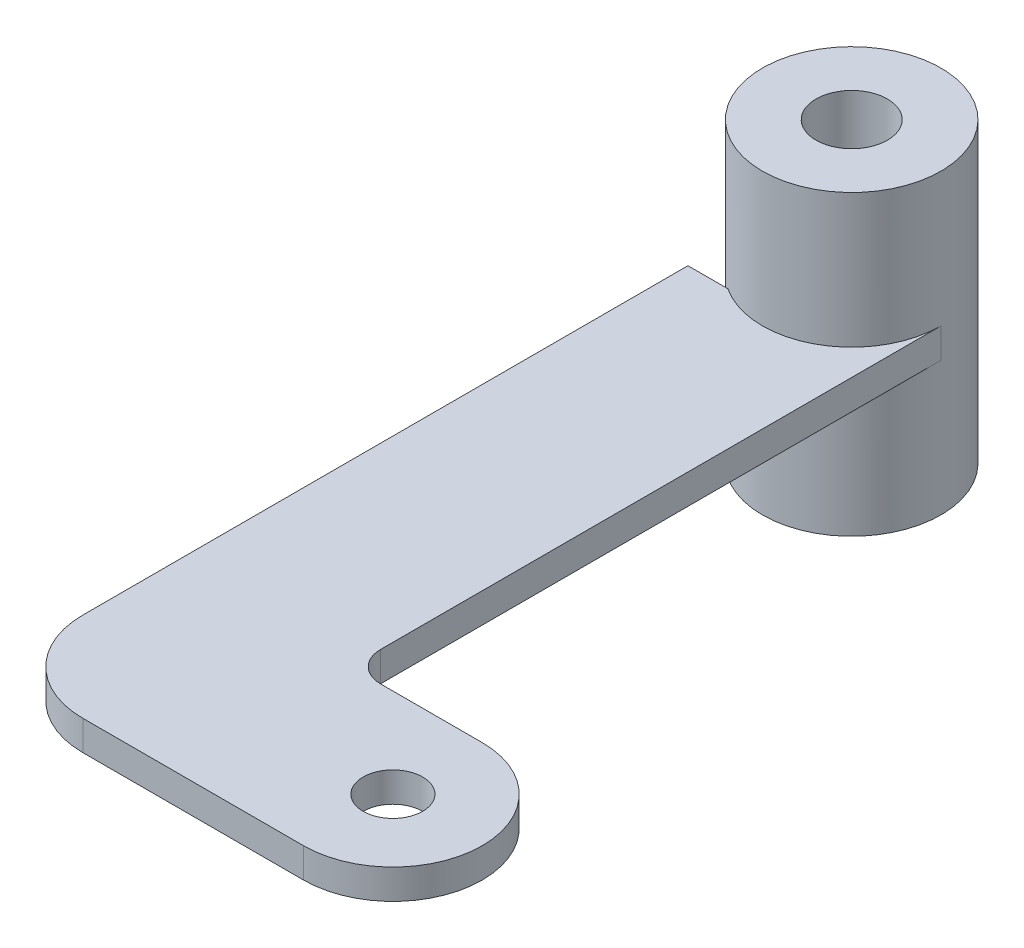
from build123d import *
from OCP.BRepFilletAPI import BRepFilletAPI_MakeFillet

# Parameters (mm, degrees)
SKETCH7_R           = 5
BOSS_EXTRUDE2_DEPTH = 2.5
FILLET2_R1          = 5
FILLET2_R2          = 15


with BuildPart() as part:
    # Sketch4 → Revolve1 (revolve)
    with BuildSketch(Plane.XY):
        Polygon((5, 5), (5, -5), (6, -5), (6, -25), (15, -25), (15, 25), (6, 25), (6, 5), align=None)
    revolve(axis=Axis((0, 25, 0), (0, -1, 0)))

    # Sketch7 → Boss-Extrude2 (add, symmetric)
    with BuildSketch(Plane(origin=(0, 0, 0), x_dir=(1, 0, 0), z_dir=(0, 1, 0))):
        with BuildLine():
            Line((-15, -12.5), (-15, -129.126781955))
            Line((-15, -129.126781955), (37.082039325, -129.126781955))
            ThreePointArc((37.082039325, -129.126781955), (52.082039325, -114.126781955), (37.082039325, -99.126781955))
            Line((37.082039325, -99.126781955), (15, -99.126781955))
            Line((15, -99.126781955), (15, 0))
            ThreePointArc((15, 0), (7.093185827, -13.216910184), (-8.291561976, -12.5))
            Line((-8.291561976, -12.5), (-15, -12.5))
        make_face()
        with Locations((37.082039325, -114.126781955)):
            Circle(SKETCH7_R, mode=Mode.SUBTRACT)
    extrude(amount=BOSS_EXTRUDE2_DEPTH, both=True)

    # Fillet2: one fillet with a radius per group of edges: ONE call of the kernel's fillet builder (fillet() takes one radius for all edges)
    fillet2_edges_1 = [part.edges().sort_by_distance(p)[0] for p in [
        (15, 0, 99.126781955),
    ]]
    fillet2_edges_2 = [part.edges().sort_by_distance(p)[0] for p in [
        (-15, 0, 129.126781955),
    ]]
    fillet2 = BRepFilletAPI_MakeFillet(part.part.solid().wrapped)
    for e in fillet2_edges_1:
        fillet2.Add(FILLET2_R1, e.wrapped)
    for e in fillet2_edges_2:
        fillet2.Add(FILLET2_R2, e.wrapped)
    add(Compound.cast(fillet2.Shape()), mode=Mode.REPLACE)


solid = part.part
